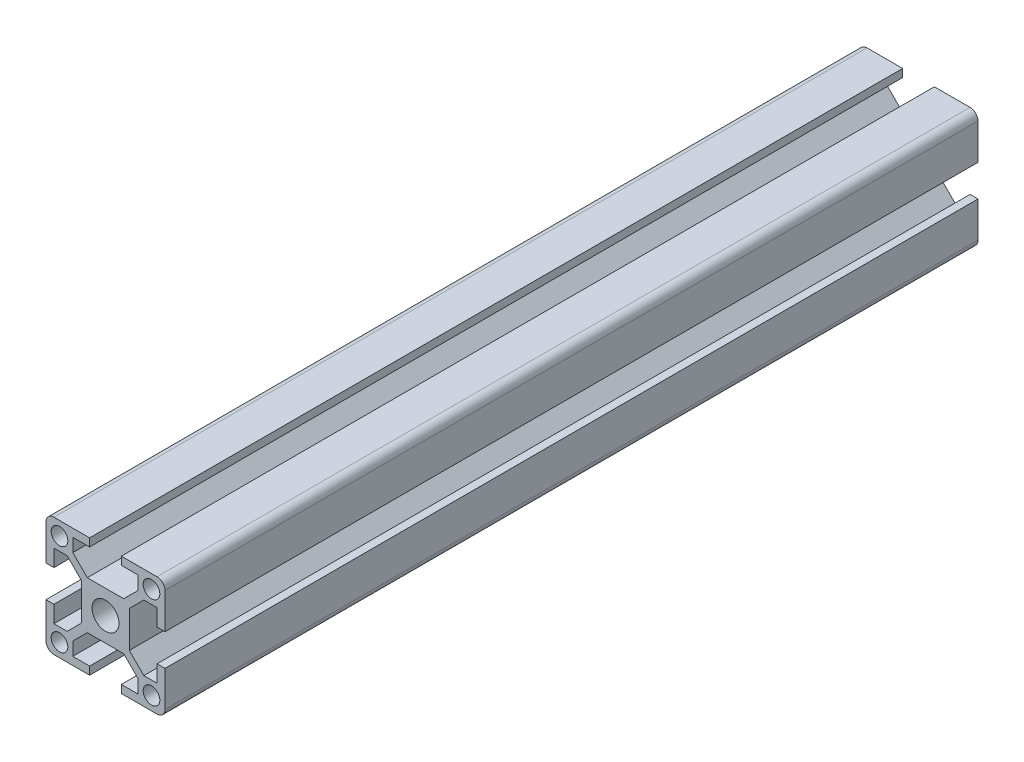
from build123d import *

# Parameters (mm, degrees)
SKETCH1_R           = 3.4
SKETCH1_R_2         = 2.1
BOSS_EXTRUDE1_DEPTH = 205
FILLET1_R           = 2


with BuildPart() as part:
    # Sketch1 → Boss-Extrude1 (new body)
    with BuildSketch(Plane.XY):
        Polygon((15, -15), (4, -15), (4, -13), (8.25, -13), (8.25, -9.664213562), (4.585786438, -6), (-4.585786438, -6), (-8.25, -9.664213562), (-8.25, -13), (-4, -13), (-4, -15), (-15, -15), (-15, -4), (-13, -4), (-13, -8.25), (-9.664213562, -8.25), (-6, -4.585786438), (-6, 4.585786438), (-9.664213562, 8.25), (-13, 8.25), (-13, 4), (-15, 4), (-15, 15), (-4, 15), (-4, 13), (-8.25, 13), (-8.25, 9.664213562), (-4.585786438, 6), (4.585786438, 6), (8.25, 9.664213562), (8.25, 13), (4, 13), (4, 15), (15, 15), (15, 4), (13, 4), (13, 8.25), (9.664213562, 8.25), (6, 4.585786438), (6, -4.585786438), (9.664213562, -8.25), (13, -8.25), (13, -4), (15, -4), align=None)
        with Locations(Location((0, 0, 0), (0, 0, 180))):
            Circle(SKETCH1_R, mode=Mode.SUBTRACT)
        with Locations(Location((-11.6, 11.6, 0), (0, 0, 180))):
            Circle(SKETCH1_R_2, mode=Mode.SUBTRACT)
        with Locations(Location((11.6, 11.6, 0), (0, 0, 180))):
            Circle(SKETCH1_R_2, mode=Mode.SUBTRACT)
        with Locations(Location((11.6, -11.6, 0), (0, 0, 180))):
            Circle(SKETCH1_R_2, mode=Mode.SUBTRACT)
        with Locations(Location((-11.6, -11.6, 0), (0, 0, 180))):
            Circle(SKETCH1_R_2, mode=Mode.SUBTRACT)
    extrude(amount=BOSS_EXTRUDE1_DEPTH)

    # Fillet1
    fillet1_edges = [part.edges().sort_by_distance(p)[0] for p in [
        (-15, -15, 102.5),
        (-15, 15, 102.5),
        (15, 15, 102.5),
        (15, -15, 102.5),
    ]]
    fillet(fillet1_edges, radius=FILLET1_R)


solid = part.part
